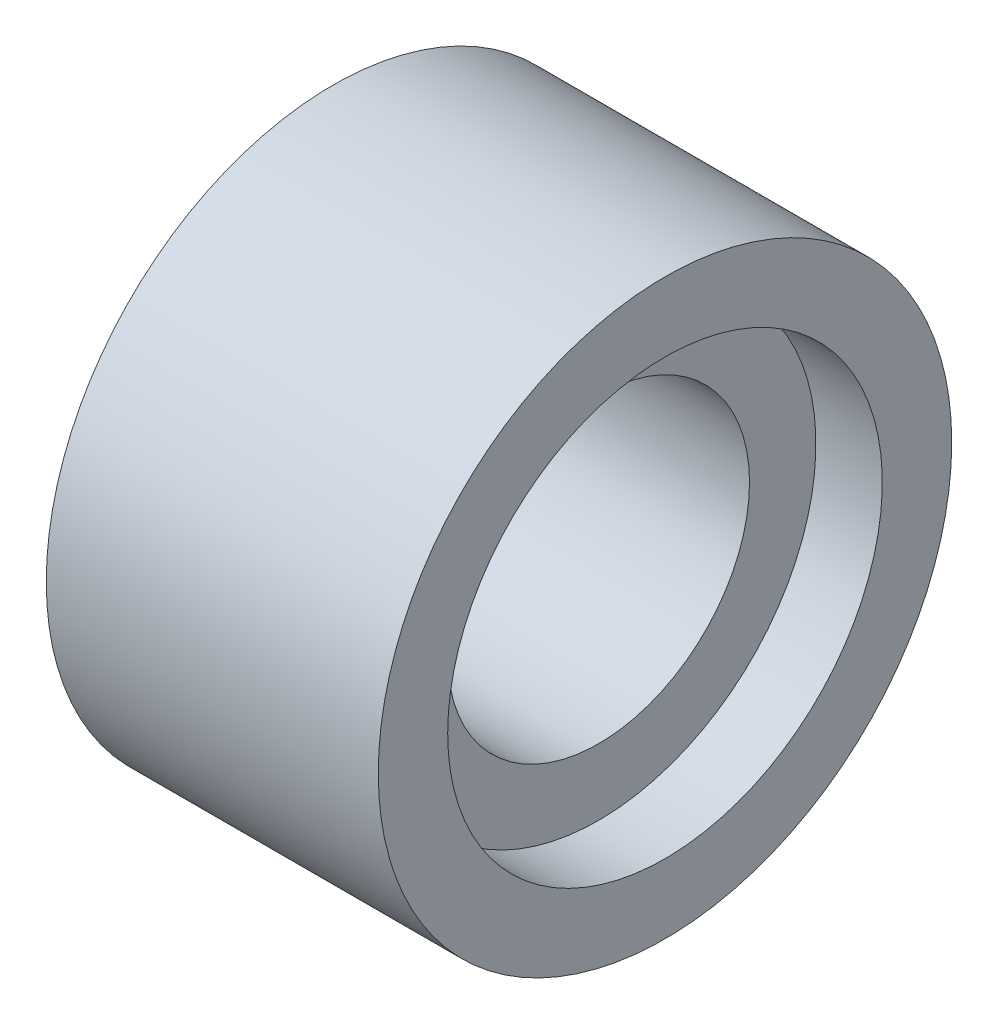
from build123d import *


with BuildPart() as part:
    # Esquisse1 → Base-Révolution (revolve)
    with BuildSketch(Plane.XY, mode=Mode.PRIVATE) as base_r_volution_sk:
        Polygon((0, 7.334147334), (0, 9.634147334), (11, 9.634147334), (11, 7.334147334), (8.8, 7.334147334), (8.8, 5.134147334), (2.2, 5.134147334), (2.2, 7.334147334), align=None)
    revolve(base_r_volution_sk.sketch.rotate(Axis((-12.574722565, 0.134147334, 0), (1, 0, 0)), 90), axis=Axis((-12.574722565, 0.134147334, 0), (1, 0, 0)))


solid = part.part
